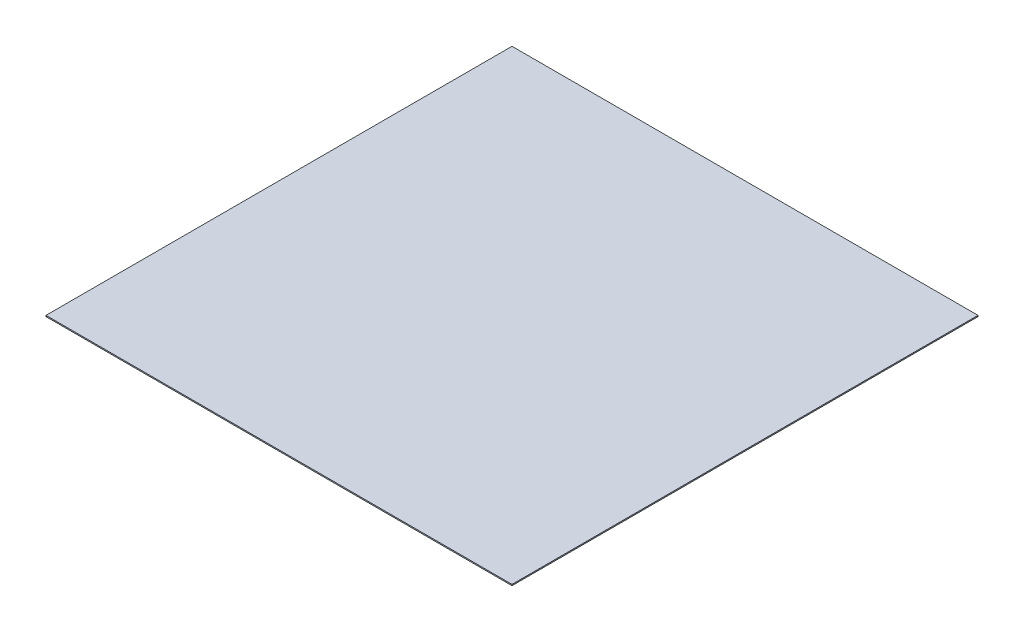
from build123d import *

# Parameters (mm, degrees)
SKETCH2_W           = 1270
SKETCH2_H           = 1270
BOSS_EXTRUDE1_DEPTH = 3.175


with BuildPart() as part:
    # Sketch2 → Boss-Extrude1 (new body)
    with BuildSketch(Plane(origin=(0, 0, 0), x_dir=(1, 0, 0), z_dir=(0, 1, 0))):
        Rectangle(SKETCH2_W, SKETCH2_H)
    extrude(amount=BOSS_EXTRUDE1_DEPTH)


solid = part.part
